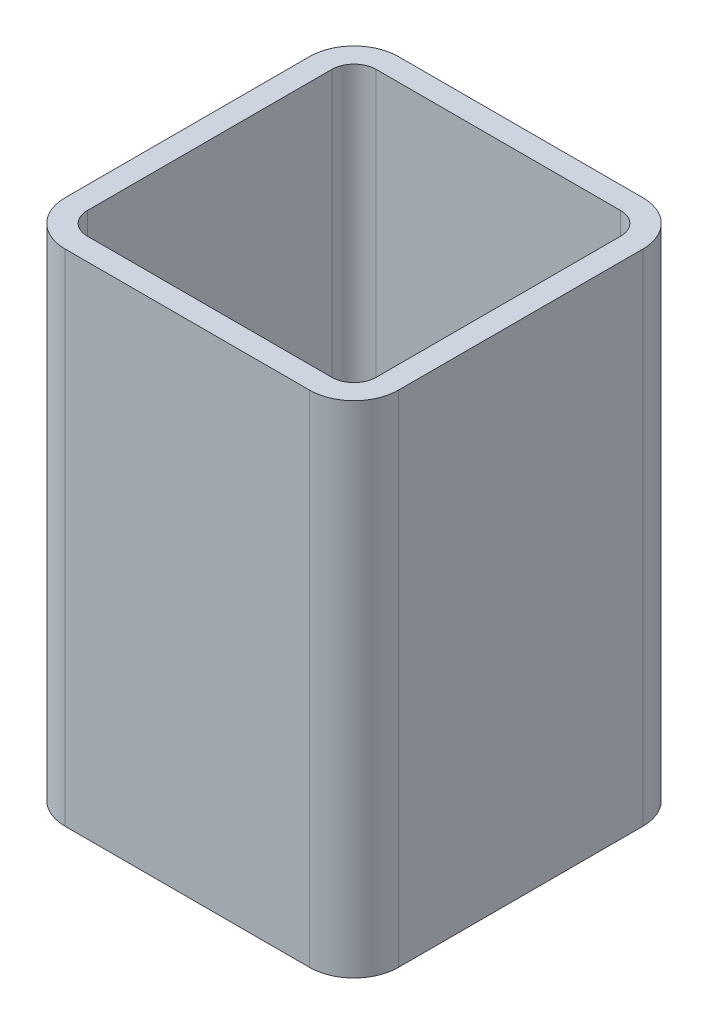
from build123d import *

# Parameters (mm, degrees)
EXTRUDE_1_DEPTH = 22.5


with BuildPart() as part:
    # 草图1 → 凸台-拉伸1 (new, symmetric)
    with BuildSketch(Plane(origin=(0, 0, 0), x_dir=(1, 0, 0), z_dir=(0, 1, 0))):
        with BuildLine():
            Line((4, 0), (26, 0))
            ThreePointArc((26, 0), (28.828427125, 1.171572875), (30, 4))
            Line((30, 4), (30, 26))
            ThreePointArc((30, 26), (28.828427125, 28.828427125), (26, 30))
            Line((26, 30), (4, 30))
            ThreePointArc((4, 30), (1.171572875, 28.828427125), (0, 26))
            Line((0, 26), (0, 4))
            ThreePointArc((0, 4), (1.171572875, 1.171572875), (4, 0))
        make_face()
        with BuildLine():
            Line((4, 2), (26, 2))
            ThreePointArc((26, 2), (27.414213562, 2.585786438), (28, 4))
            Line((28, 4), (28, 26))
            ThreePointArc((28, 26), (27.414213562, 27.414213562), (26, 28))
            Line((26, 28), (4, 28))
            ThreePointArc((4, 28), (2.585786438, 27.414213562), (2, 26))
            Line((2, 26), (2, 4))
            ThreePointArc((2, 4), (2.585786438, 2.585786438), (4, 2))
        make_face(mode=Mode.SUBTRACT)
    extrude(amount=EXTRUDE_1_DEPTH, both=True)


solid = part.part
